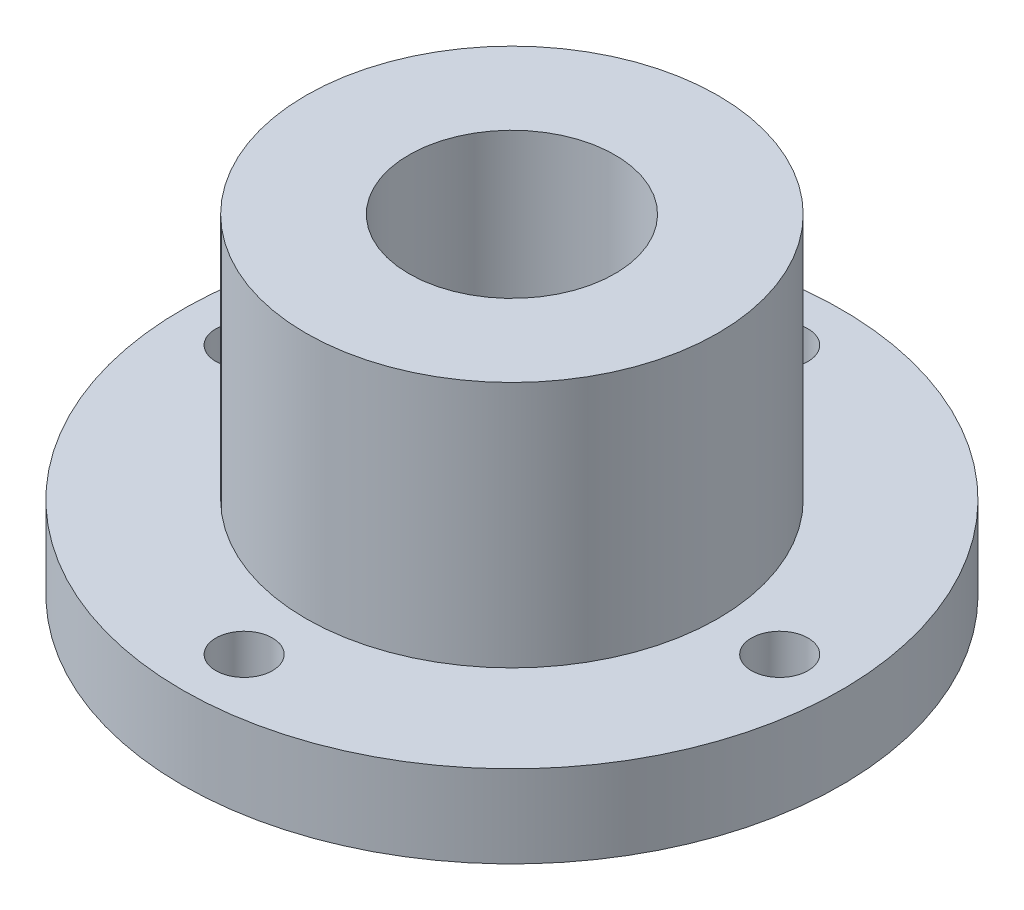
from build123d import *

# Parameters (mm, degrees)
SKETCH_2_R          = 2.75
CUT_EXTRUDE_1_DEPTH = 10


with BuildPart() as part:
    # 草图1 → 旋转1 (revolve)
    with BuildSketch(Plane.XY, mode=Mode.PRIVATE) as revolve_1_sk:
        Polygon((-10, 0), (-32, 0), (-32, 8), (-20, 8), (-20, 32), (-10, 32), align=None)
    revolve(revolve_1_sk.sketch.rotate(Axis((0, 79.352678571, 0), (0, -1, 0)), 270), axis=Axis((0, 79.352678571, 0), (0, -1, 0)))

    # 草图2 → 切除-拉伸1 (cut)
    with BuildSketch(Plane(origin=(0, 8, 0), x_dir=(1, 0, 0), z_dir=(0, 1, 0))):
        with Locations(Location((0, 26, 0), (0, 0, 270))):
            Circle(SKETCH_2_R)
        with Locations(Location((26, 0, 0), (0, 0, 270))):
            Circle(SKETCH_2_R)
        with Locations(Location((0, -26, 0), (0, 0, 270))):
            Circle(SKETCH_2_R)
        with Locations(Location((-26, 0, 0), (0, 0, 270))):
            Circle(SKETCH_2_R)
    extrude(amount=-CUT_EXTRUDE_1_DEPTH, mode=Mode.SUBTRACT)


solid = part.part
